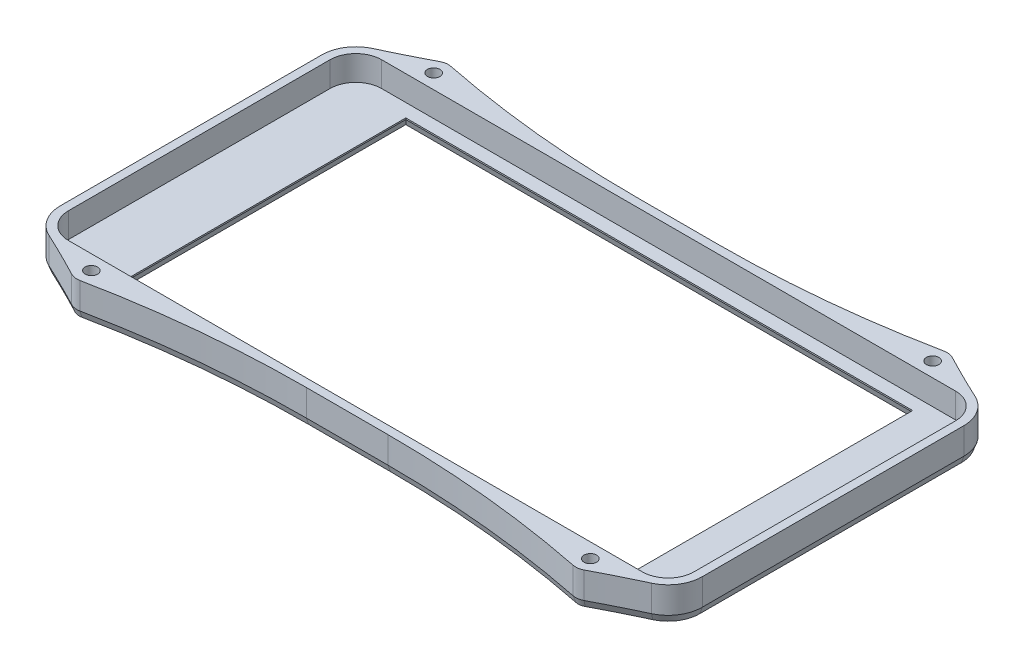
from build123d import *

# Parameters (mm, degrees)
EXTRUDE_1_DEPTH     = 2
EXTRUDE_2_DEPTH     = 8
SKETCH_6_R          = 3.5
SKETCH_6_R_2        = 1.5
EXTRUDE_10_DEPTH    = 8
SKETCH_7_W          = 121.7
SKETCH_7_H          = 68.8
CUT_EXTRUDE_1_DEPTH = 10
FILLET_1_R          = 250
SKETCH_6_2_R        = 1.5
EXTRUDE_11_DEPTH    = 1.5
CUT_EXTRUDE_4_DEPTH = 1.5
SKETCH_10_5_W       = 0.697572757
SKETCH_10_5_H       = 3.459391428
SKETCH_10_5_W_2     = 0.553502628
SKETCH_10_5_W_3     = 0.441214251
SKETCH_10_5_H_2     = 2.30447035
CUT_EXTRUDE_5_DEPTH = 0.6
CHAMFER_1_SIZE      = 0.6
CHAMFER_1_SIZE2     = 1.648486452


with BuildPart() as part:
    # 草图1 → 凸台-拉伸1 (new body)
    with BuildSketch(Plane(origin=(0, 0, 0), x_dir=(1, 0, 0), z_dir=(0, 1, 0))):
        with BuildLine():
            Line((6, 0.2), (143.8, 0.2))
            ThreePointArc((143.8, 0.2), (148.184062043, -1.615937957), (150, -6))
            Line((150, -6), (150, -68.8))
            ThreePointArc((150, -68.8), (148.184062043, -73.184062043), (143.8, -75))
            Line((143.8, -75), (6, -75))
            ThreePointArc((6, -75), (1.615937957, -73.184062043), (-0.2, -68.8))
            Line((-0.2, -68.8), (-0.2, -6))
            ThreePointArc((-0.2, -6), (1.615937957, -1.615937957), (6, 0.2))
        make_face()
    extrude(amount=EXTRUDE_1_DEPTH)

    # 草图1<5> → 拉伸-薄壁2 (add)
    with BuildSketch(Plane(origin=(0, 0, 0), x_dir=(1, 0, 0), z_dir=(0, 1, 0))):
        with BuildLine():
            Line((6, 2.2), (143.8, 2.2))
            ThreePointArc((143.8, 2.2), (149.598275606, -0.201724394), (152, -6))
            Line((152, -6), (152, -68.8))
            ThreePointArc((152, -68.8), (149.598275606, -74.598275606), (143.8, -77))
            Line((143.8, -77), (6, -77))
            ThreePointArc((6, -77), (0.201724394, -74.598275606), (-2.2, -68.8))
            Line((-2.2, -68.8), (-2.2, -6))
            ThreePointArc((-2.2, -6), (0.201724394, -0.201724394), (6, 2.2))
        make_face()
        with BuildLine():
            Line((6, 0.2), (143.8, 0.2))
            ThreePointArc((143.8, 0.2), (148.184062043, -1.615937957), (150, -6))
            Line((150, -6), (150, -68.8))
            ThreePointArc((150, -68.8), (148.184062043, -73.184062043), (143.8, -75))
            Line((143.8, -75), (6, -75))
            ThreePointArc((6, -75), (1.615937957, -73.184062043), (-0.2, -68.8))
            Line((-0.2, -68.8), (-0.2, -6))
            ThreePointArc((-0.2, -6), (1.615937957, -1.615937957), (6, 0.2))
        make_face(mode=Mode.SUBTRACT)
    extrude(amount=EXTRUDE_2_DEPTH)

    # 草图6 → 凸台-拉伸10 (add)
    # profile 1 of 4: a face of its own
    with BuildSketch(Plane(origin=(0, 0, 0), x_dir=(1, 0, 0), z_dir=(0, 1, 0))):
        with Locations((15, 3.7)):
            Circle(SKETCH_6_R)
        with Locations(Location((15, 3.7, 0), (0, 0, 90))):
            Circle(SKETCH_6_R_2, mode=Mode.SUBTRACT)
    # profile 2 of 4: a face of its own
    with BuildSketch(Plane(origin=(0, 0, 0), x_dir=(1, 0, 0), z_dir=(0, 1, 0))):
        with Locations((15, -78.5)):
            Circle(SKETCH_6_R)
        with Locations(Location((15, -78.5, 0), (0, 0, 90))):
            Circle(SKETCH_6_R_2, mode=Mode.SUBTRACT)
    # profile 3 of 4: a face of its own
    with BuildSketch(Plane(origin=(0, 0, 0), x_dir=(1, 0, 0), z_dir=(0, 1, 0))):
        with Locations((134.8, 3.7)):
            Circle(SKETCH_6_R)
        with Locations(Location((134.8, 3.7, 0), (0, 0, 90))):
            Circle(SKETCH_6_R_2, mode=Mode.SUBTRACT)
    # profile 4 of 4: a face of its own
    with BuildSketch(Plane(origin=(0, 0, 0), x_dir=(1, 0, 0), z_dir=(0, 1, 0))):
        with Locations((134.8, -78.5)):
            Circle(SKETCH_6_R)
        with Locations(Location((134.8, -78.5, 0), (0, 0, 90))):
            Circle(SKETCH_6_R_2, mode=Mode.SUBTRACT)
    extrude(amount=EXTRUDE_10_DEPTH)

    # 草图7 → 切除-拉伸1 (cut)
    with BuildSketch(Plane(origin=(0, 0, 0), x_dir=(-1, 0, 0), z_dir=(0, -1, 0))):
        with Locations((-75.85, -37.4)):
            Rectangle(SKETCH_7_W, SKETCH_7_H)
    extrude(amount=-CUT_EXTRUDE_1_DEPTH, mode=Mode.SUBTRACT)

    # 圆角1
    fillet_1_edges = [part.edges().sort_by_distance(p)[0] for p in [
        (18.16227766, 4, 77),
        (11.83772234, 4, 77),
        (137.96227766, 4, 77),
        (131.63772234, 4, 77),
        (131.63772234, 4, -2.2),
        (137.96227766, 4, -2.2),
        (11.83772234, 4, -2.2),
        (18.16227766, 4, -2.2),
    ]]
    fillet(fillet_1_edges, radius=FILLET_1_R)

    # 草图6<2> → 凸台-拉伸11 (add)
    with BuildSketch(Plane(origin=(0, 0, 0), x_dir=(1, 0, 0), z_dir=(0, 1, 0))):
        with Locations(Location((15, 3.7, 0), (0, 0, 90))):
            Circle(SKETCH_6_2_R)
        with Locations(Location((15, -78.5, 0), (0, 0, 90))):
            Circle(SKETCH_6_2_R)
        with Locations(Location((134.8, 3.7, 0), (0, 0, 90))):
            Circle(SKETCH_6_2_R)
        with Locations(Location((134.8, -78.5, 0), (0, 0, 90))):
            Circle(SKETCH_6_2_R)
    extrude(amount=EXTRUDE_11_DEPTH)

    # 草图10 → 切除-拉伸4 (cut)
    with BuildSketch(Plane.XZ):
        with BuildLine():
            Line((5.571127469, 39.660442156), (-0.277638416, 33.811676271))
            Line((-0.277638416, 33.811676271), (0.957224649, 33.811676271))
            Line((0.957224649, 33.811676271), (6.106730727, 38.961182348))
            Line((6.106730727, 38.961182348), (12.481897273, 32.586015802))
            Line((12.481897273, 32.586015802), (13.828976111, 32.586015802))
            Line((13.828976111, 32.586015802), (6.590261445, 39.660442156))
            Line((6.590261445, 39.660442156), (6.590261445, 41.170545784))
            Line((6.590261445, 41.170545784), (8.885172623, 41.170545784))
            ThreePointArc((8.885172623, 41.170545784), (9.169711853, 41.455085014), (8.885172623, 41.739624244))
            Line((8.885172623, 41.739624244), (5.812892829, 41.739624244))
            ThreePointArc((5.812892829, 41.739624244), (5.641938904, 41.66881281), (5.571127469, 41.497858885))
            Line((5.571127469, 41.497858885), (5.571127469, 39.660442156))
        make_face()
        Polygon((12.64711827, 41.973363919), (12.805045211, 41.973363919), (12.805045211, 42.780222079), (12.726081741, 42.827309898), (12.42887586, 42.827309898), (10.806902843, 44.449282916), (10.806902843, 44.132307585), (12.219623225, 42.719587202), (10.834641668, 41.334605645), (10.834641668, 41.017888001), (12.42887586, 42.612122193), (12.64711827, 42.612122193), align=None)
    extrude(amount=-CUT_EXTRUDE_4_DEPTH, mode=Mode.SUBTRACT)

    # 草图10<5> → 切除-拉伸5 (cut)
    # profile 1 of 11: a face of its own
    with BuildSketch(Plane.XZ):
        Polygon((6.590261445, 39.660442156), (13.828976111, 32.586015802), (13.828976111, 35.667004219), (8.325434547, 41.170545784), (6.590261445, 41.170545784), align=None)
    # profile 2 of 11: a face of its own
    with BuildSketch(Plane.XZ):
        Polygon((-1.503298885, 35.667004219), (-1.503298885, 32.586015802), (5.571127469, 39.660442156), (5.571127469, 41.095548376), (3.925245273, 41.095548376), align=None)
    # profile 3 of 11: a face of its own
    with BuildSketch(Plane.XZ):
        with Locations((13.15383159, 42.719587202)):
            Rectangle(SKETCH_10_5_W, SKETCH_10_5_H)
    # profile 4 of 11: a face of its own
    with BuildSketch(Plane.XZ):
        Polygon((11.431005121, 41.017888001), (12.64711827, 42.23400115), (12.64711827, 42.612122193), (12.42887586, 42.612122193), (10.834641668, 41.017888001), align=None)
    # profile 5 of 11: a face of its own
    with BuildSketch(Plane.XZ):
        Polygon((12.42887586, 42.827309898), (12.64711827, 42.827309898), (12.64711827, 43.22875954), (11.431005121, 44.44487269), (10.806902843, 44.449282916), align=None)
    # profile 6 of 11: a face of its own
    with BuildSketch(Plane.XZ):
        with Locations((10.075685028, 42.719587202)):
            Rectangle(SKETCH_10_5_W_2, SKETCH_10_5_H)
    # profile 7 of 11: a face of its own
    with BuildSketch(Plane.XZ):
        with Locations((8.850383878, 43.297047741)):
            Rectangle(SKETCH_10_5_W_3, SKETCH_10_5_H_2)
    # profile 8 of 11: a face of its own
    with BuildSketch(Plane.XZ):
        with BuildLine():
            Line((2.226409005, 43.276038377), (0.553713614, 43.276038377))
            add(Edge.make_bspline(
                [(1.644432546, 41.978861933), (1.566711702, 41.978724516), (1.452221709, 41.987444356), (1.305065674, 42.018772372), (1.20297698, 42.052616889), (1.106437917, 42.094600761), (1.015851526, 42.146374591), (0.932005805, 42.208654396), (0.851960171, 42.278215044), (0.781755621, 42.361235021), (0.719494043, 42.455254135), (0.668278484, 42.562455772), (0.626603413, 42.681732888), (0.592918167, 42.813010077), (0.561613132, 43.012000734), (0.55361651, 43.168297666), (0.553713614, 43.276038377)],
                knots=[0, 0, 0, 0, 0.120486154, 0.177350141, 0.232866661, 0.286955745, 0.34034489, 0.394223743, 0.448695149, 0.504379338, 0.56222843, 0.623097026, 0.688047874, 0.757874258, 0.832940742, 1, 1, 1, 1], degree=3))
            add(Edge.make_bspline(
                [(2.830199843, 43.226176941), (2.830205916, 43.134662526), (2.820293896, 43.000171838), (2.786078635, 42.827768949), (2.749089372, 42.709039809), (2.701824625, 42.598163845), (2.643142636, 42.495190823), (2.575879449, 42.398698678), (2.496547912, 42.311973601), (2.410680459, 42.23347486), (2.318235451, 42.16483292), (2.219346888, 42.108466198), (2.115885186, 42.059735147), (2.0059038, 42.023633793), (1.849128316, 41.988620292), (1.727095891, 41.979161916), (1.644432546, 41.978861933)],
                knots=[0, 0, 0, 0, 0.141620464, 0.208078497, 0.271649737, 0.333774745, 0.394254952, 0.454816592, 0.515440902, 0.575767288, 0.634699447, 0.693235438, 0.751688555, 0.811433572, 0.871995213, 1, 1, 1, 1], degree=3))
            add(Edge.make_bspline(
                [(1.644432546, 44.473491948), (1.727133935, 44.473333627), (1.849309941, 44.463444902), (2.006258275, 44.429030905), (2.116251581, 44.392233568), (2.219974004, 44.344129668), (2.319003385, 44.287489424), (2.411450493, 44.218879699), (2.497376078, 44.140410924), (2.576327959, 44.053688391), (2.64431226, 43.958083959), (2.701616102, 43.854701297), (2.749162391, 43.744135163), (2.78605331, 43.625351614), (2.820388364, 43.452719726), (2.83009654, 43.317933767), (2.830199843, 43.226176941)],
                knots=[0, 0, 0, 0, 0.127972663, 0.188911288, 0.248260192, 0.307063691, 0.365584991, 0.424502361, 0.484813608, 0.545422703, 0.605641492, 0.665909877, 0.728019294, 0.79157458, 0.858015935, 1, 1, 1, 1], degree=3))
            add(Edge.make_bspline(
                [(1.644432546, 44.473491948), (1.134188378, 44.499685644), (0.671355442, 44.285732475)],
                knots=[0, 0, 0, 1, 1, 1], degree=2))
            Line((0.671355442, 44.285732475), (0.822989761, 43.838537712))
            add(Edge.make_bspline(
                [(1.644432546, 44.002145552), (1.215019372, 44.011494044), (0.822989761, 43.838537712)],
                knots=[0, 0, 0, 1, 1, 1], degree=2))
            add(Edge.make_bspline(
                [(2.226409005, 43.276038377), (2.227385286, 43.338026107), (2.221699745, 43.427379273), (2.203721411, 43.540802377), (2.185428788, 43.615385161), (2.160346038, 43.682314857), (2.131005083, 43.74230618), (2.09559935, 43.794541455), (2.041683855, 43.852885543), (1.966172147, 43.912178734), (1.832545283, 43.98338782), (1.719323564, 44.002296574), (1.644432546, 44.002145552)],
                knots=[0, 0, 0, 0, 0.176057164, 0.253825871, 0.326136782, 0.393854395, 0.456561131, 0.515511967, 0.572451452, 0.681712628, 0.786682582, 1, 1, 1, 1], degree=3))
        make_face()
        with BuildLine():
            Line((1.178539745, 42.845983484), (2.205373712, 42.845983484))
            add(Edge.make_bspline(
                [(1.685724049, 42.42995212), (1.73899164, 42.430050539), (1.818863898, 42.442207298), (1.918861528, 42.482229458), (1.99047919, 42.524739295), (2.057694796, 42.580938715), (2.139029693, 42.684694123), (2.182210833, 42.778440473), (2.205373712, 42.845983484)],
                knots=[0, 0, 0, 0, 0.223313573, 0.334801165, 0.450099962, 0.571478619, 0.700127295, 1, 1, 1, 1], degree=3))
            add(Edge.make_bspline(
                [(1.178539745, 42.845983484), (1.18995993, 42.7820456), (1.217933055, 42.690984866), (1.28443672, 42.588532515), (1.345123476, 42.529601175), (1.416599422, 42.484939357), (1.528715738, 42.440263229), (1.621992117, 42.429544766), (1.685724049, 42.42995212)],
                knots=[0, 0, 0, 0, 0.269610706, 0.388375219, 0.502502321, 0.617120294, 0.735396465, 1, 1, 1, 1], degree=3))
        make_face(mode=Mode.SUBTRACT)
    # profile 9 of 11: a face of its own
    with BuildSketch(Plane.XZ):
        with BuildLine():
            Line((7.319954366, 44.392155706), (7.207160016, 44.420181156))
            add(Edge.make_bspline(
                [(7.874724026, 42.14481051), (7.498041908, 42.051502165), (6.905296116, 42.020716461), (6.379896935, 42.162314815), (6.008686099, 42.391116728), (5.771910898, 42.883589689), (5.78389815, 43.758558066), (5.988124863, 44.176623215), (6.45392105, 44.439625167), (6.837345199, 44.505916494), (7.049764631, 44.454930786), (7.207160016, 44.420181156)],
                knots=[0, 0, 0, 0, 0.248699018, 0.269163178, 0.292864367, 0.485710908, 0.623698159, 0.822274913, 0.850786427, 0.908813291, 1, 1, 1, 1], degree=3))
            Line((7.874724026, 42.14481051), (7.894323604, 45.234926749))
            Line((7.894323604, 45.234926749), (7.319954366, 45.234926749))
            Line((7.319954366, 45.234926749), (7.319954366, 44.392155706))
        make_face()
        with BuildLine():
            Line((7.319954366, 43.894154635), (7.319954366, 42.581725319))
            add(Edge.make_bspline(
                [(7.319954366, 42.581725319), (7.073411833, 42.462903878), (6.449364115, 42.59348675), (6.363450846, 43.246008638), (6.364528772, 43.79599664), (6.860733263, 44.032222825), (7.231655128, 43.960897666), (7.319954366, 43.894154635)],
                knots=[0, 0, 0, 0, 0.259397994, 0.395260335, 0.549467569, 0.69629813, 0.820988749, 0.820988749, 0.820988749, 0.820988749], degree=3))
        make_face(mode=Mode.SUBTRACT)
    # profile 10 of 11: a face of its own
    with BuildSketch(Plane.XZ):
        with BuildLine():
            Line((4.680520894, 44.400728523), (4.624332659, 44.384278529))
            add(Edge.make_bspline(
                [(5.223191818, 42.149154138), (4.8465097, 42.055845793), (4.253453722, 42.024197462), (3.731152348, 42.166153737), (3.380699473, 42.373534458), (3.113051294, 42.891728783), (3.136043644, 43.768294328), (3.332263455, 44.15385888), (3.793004774, 44.427568402), (4.171969833, 44.531259829), (4.466937274, 44.41902816), (4.624332659, 44.384278529)],
                knots=[0, 0, 0, 0, 0.26204213, 0.283604225, 0.306987272, 0.495872599, 0.631025486, 0.825523322, 0.853465846, 0.910450726, 1, 1, 1, 1], degree=3))
            Line((5.223191818, 42.149154138), (5.249118727, 45.234926749))
            Line((5.249118727, 45.234926749), (4.680520894, 45.234926749))
            Line((4.680520894, 45.234926749), (4.680520894, 44.400728523))
        make_face()
        with BuildLine():
            Line((4.659594719, 43.894213096), (4.659594719, 42.581783781))
            add(Edge.make_bspline(
                [(4.659594719, 42.581783781), (4.413052186, 42.46296234), (3.789004468, 42.593545211), (3.703091199, 43.246067099), (3.704169125, 43.796055101), (4.200373617, 44.032281287), (4.571295481, 43.960956127), (4.659594719, 43.894213096)],
                knots=[0, 0, 0, 0, 0.259397994, 0.395260335, 0.549467569, 0.69629813, 0.820988749, 0.820988749, 0.820988749, 0.820988749], degree=3))
        make_face(mode=Mode.SUBTRACT)
    # profile 11 of 11: a face of its own
    with BuildSketch(Plane.XZ):
        with BuildLine():
            Line((-1.302594887, 42.246920324), (-1.264287112, 42.131997))
            add(Edge.make_bspline(
                [(0.114792777, 42.246920324), (-0.343371404, 42.062996391), (-0.723012207, 42.0487839), (-1.264287112, 42.131997)],
                knots=[0, 0, 0, 0, 0.886160748, 0.886160748, 0.886160748, 0.886160748], degree=3))
            Line((0.114792777, 42.246920324), (0.114792777, 44.449282916))
            Line((0.114792777, 44.449282916), (-0.457738977, 44.449282916))
            Line((-0.457738977, 44.449282916), (-0.421516069, 42.591690296))
            Line((-0.421516069, 42.591690296), (-1.264287112, 42.612122193))
            Line((-1.264287112, 42.612122193), (-1.302594887, 42.246920324))
        make_face()
    extrude(amount=-CUT_EXTRUDE_5_DEPTH, mode=Mode.SUBTRACT)

    # 倒角1
    chamfer_1_edges = [part.edges().sort_by_distance(p)[0] for p in [
        (136.7, 0, 37.4),
        (75.85, 0, 71.8),
        (15, 0, 37.4),
        (75.85, 0, 3),
        (14.502874151, 0, 81.964515246),
        (74.9, 0, 77),
        (135.297125849, 0, 81.964515246),
        (150.714252509, 0, 73.20830038),
        (135.297125849, 0, -7.164515246),
        (74.9, 0, -2.2),
        (14.502874151, 0, -7.164515246),
        (-0.914252509, 0, 1.59169962),
        (7.988030543, 0, 78.850628869),
        (40.273083878, 0, 78.235796001),
        (141.811969457, 0, 78.850628869),
        (109.526916122, 0, 78.235796001),
        (141.811969457, 0, -4.050628869),
        (109.526916122, 0, -3.435796001),
        (7.988030543, 0, -4.050628869),
        (40.273083878, 0, -3.435796001),
        (-2.2, 0, 37.4),
        (-0.914252509, 0, 73.20830038),
        (152, 0, 37.4),
        (150.714252509, 0, 1.59169962),
    ]]
    chamfer_1_side = [part.faces().sort_by_distance(p)[0] for p in [
        (0.58783664, 0, 72.250617658),
    ]]
    chamfer(chamfer_1_edges, length=CHAMFER_1_SIZE, length2=CHAMFER_1_SIZE2, reference=chamfer_1_side[0])


solid = part.part
